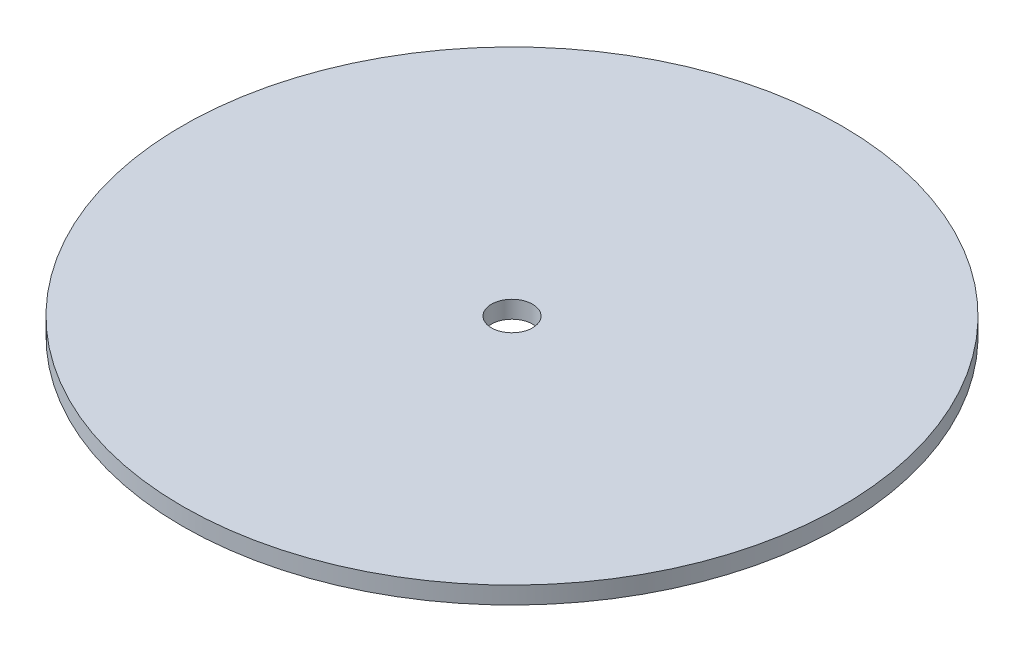
from build123d import *

# Parameters (mm, degrees)
SKETCH1_R           = 76.2
SKETCH1_R_2         = 4.75
BOSS_EXTRUDE1_DEPTH = 4


with BuildPart() as part:
    # Sketch1 → Boss-Extrude1 (new body)
    with BuildSketch(Plane(origin=(0, 0, 0), x_dir=(1, 0, 0), z_dir=(0, 1, 0))):
        with Locations(Location((0, 0, 0), (0, 0, 270))):
            Circle(SKETCH1_R)
        with Locations(Location((0, 0, 0), (0, 0, 270))):
            Circle(SKETCH1_R_2, mode=Mode.SUBTRACT)
    extrude(amount=BOSS_EXTRUDE1_DEPTH)


solid = part.part
